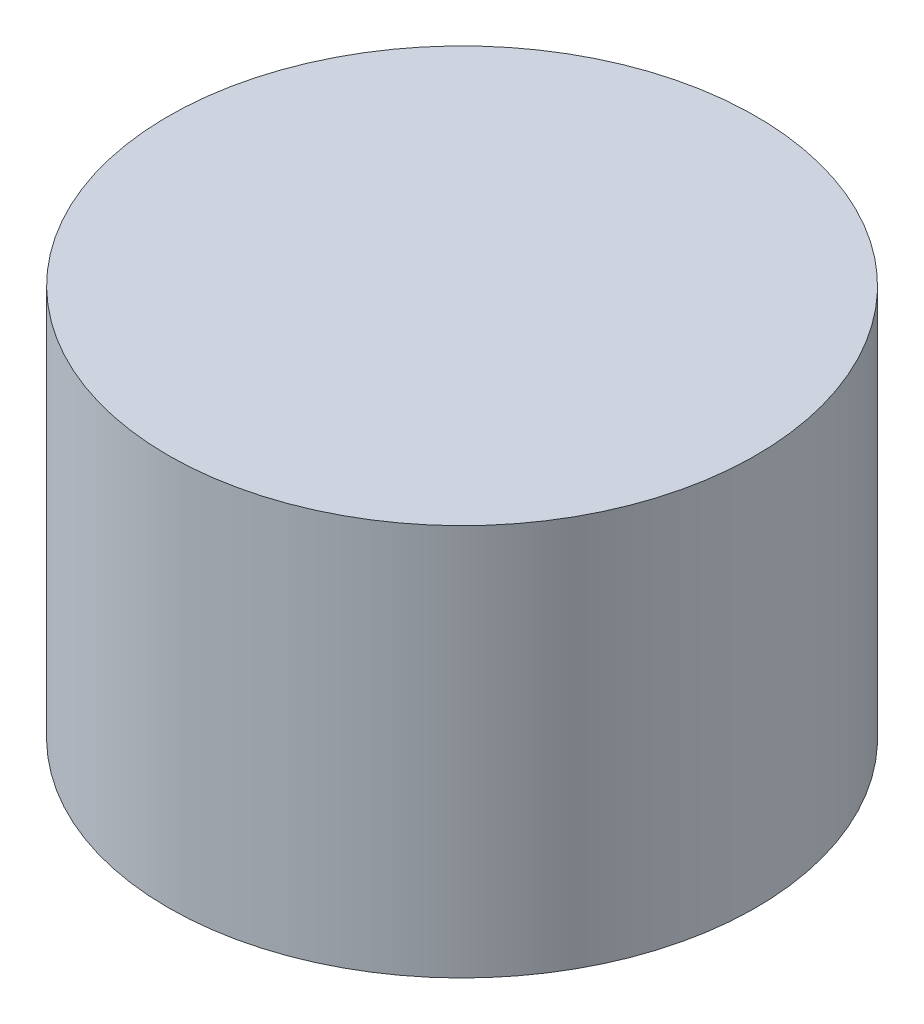
from build123d import *

# Parameters (mm, degrees)
SKETCH1_R   = 24
MOTOR_DEPTH = 32


with BuildPart() as part:
    # Sketch1 → Motor (new body)
    with BuildSketch(Plane(origin=(0, 0, 0), x_dir=(1, 0, 0), z_dir=(0, 1, 0))):
        with Locations(Location((0, 0, 0), (0, 0, 270))):
            Circle(SKETCH1_R)
    extrude(amount=MOTOR_DEPTH)


solid = part.part
